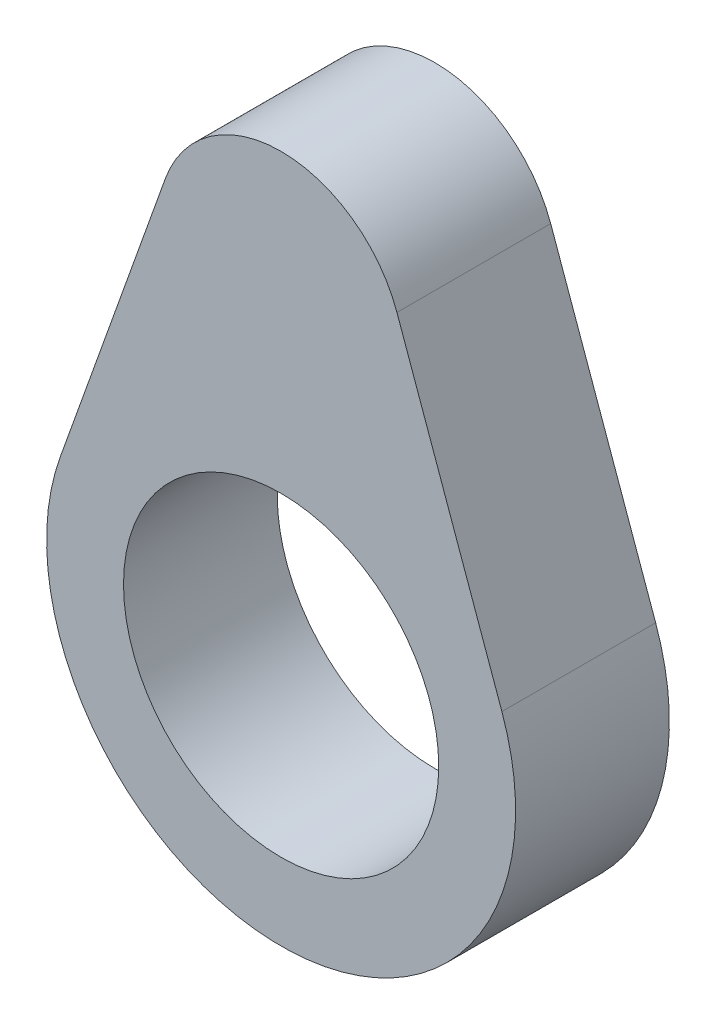
from build123d import *

# Parameters (mm, degrees)
SKETCH1_R           = 7.625014315
SKETCH1_R_2         = 5.125
BOSS_EXTRUDE1_DEPTH = 5
FILLET1_R           = 4


with BuildPart() as part:
    # Sketch1 → Boss-Extrude1 (new body)
    # profile 1 of 3: a face of its own
    with BuildSketch(Plane.XY):
        Circle(SKETCH1_R)
        Circle(SKETCH1_R_2, mode=Mode.SUBTRACT)
    # profile 2 of 3: a face of its own
    with BuildSketch(Plane.XY):
        with BuildLine():
            ThreePointArc((-7.178939445, 2.56976103), (-4.390124068, 6.234392831), (0, 7.625014315))
            Line((0, 7.625014315), (0, 22.625))
            Line((0, 22.625), (-7.178939445, 2.56976103))
        make_face()
    # profile 3 of 3: a face of its own
    with BuildSketch(Plane.XY):
        with BuildLine():
            Line((0, 22.625), (0, 7.625014315))
            ThreePointArc((0, 7.625014315), (4.390124068, 6.234392831), (7.178939445, 2.56976103))
            Line((7.178939445, 2.56976103), (0, 22.625))
        make_face()
    extrude(amount=BOSS_EXTRUDE1_DEPTH)

    # Fillet1
    fillet1_edges = [part.edges().sort_by_distance(p)[0] for p in [
        (0, 22.625, 2.5),
    ]]
    fillet(fillet1_edges, radius=FILLET1_R)


solid = part.part
